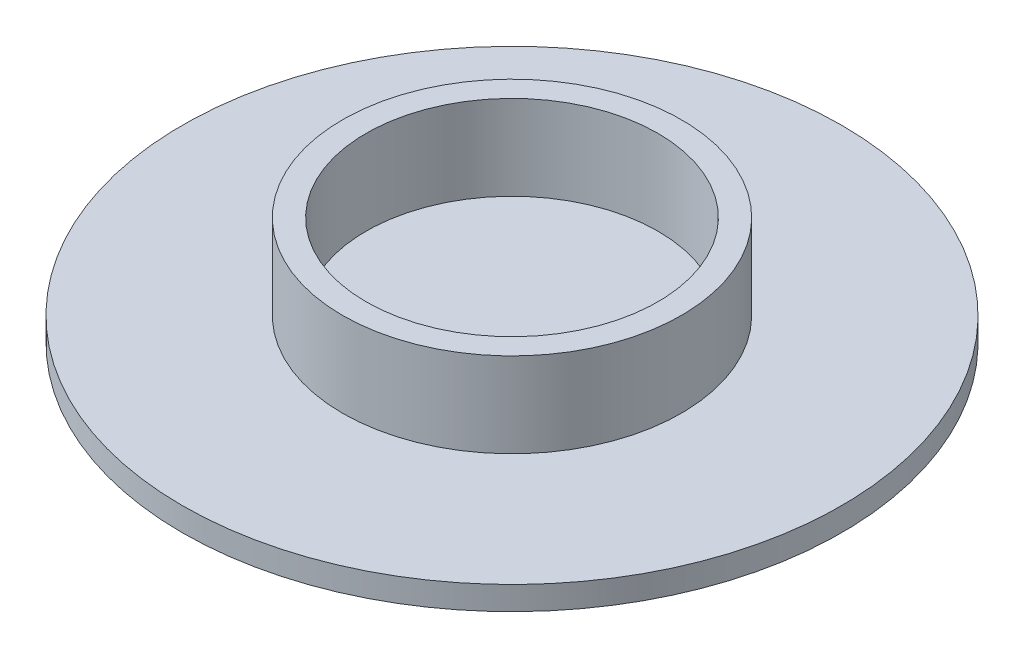
from build123d import *


with BuildPart() as part:
    # Sketch1 → Revolve1 (revolve)
    with BuildSketch(Plane(origin=(0, 0, 0), x_dir=(0, 0, -1), z_dir=(1, 0, 0)), mode=Mode.PRIVATE) as revolve1_sk:
        Polygon((0, 0), (70, 0), (70, 5), (36, 5), (36, 23), (31, 23), (31, 5), (0, 5), align=None)
    revolve(revolve1_sk.sketch.rotate(Axis((0, 5, 0), (0, -1, 0)), 180), axis=Axis((0, 5, 0), (0, -1, 0)))


solid = part.part
